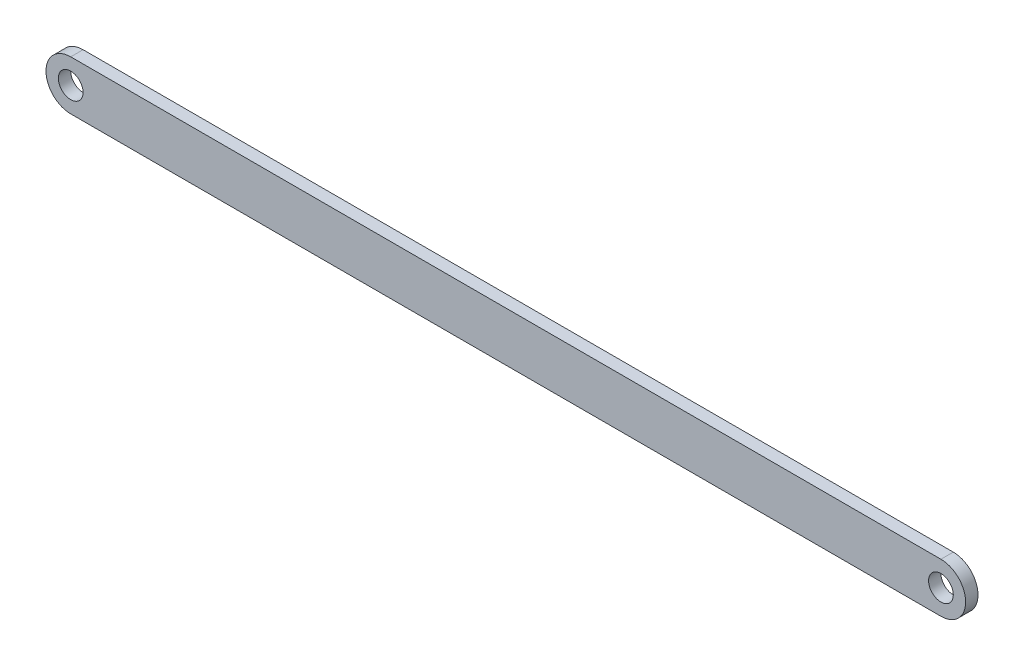
from build123d import *

# Parameters (mm, degrees)
ESBO_O1_R                = 1
RESSALTO_EXTRUS_O1_DEPTH = 1


with BuildPart() as part:
    # Esboço1 → Ressalto-extrusão1 (new body)
    with BuildSketch(Plane.XY):
        with BuildLine():
            Line((-35.21, 2), (35.21, 2))
            ThreePointArc((35.21, 2), (37.21, 0), (35.21, -2))
            Line((35.21, -2), (-35.21, -2))
            ThreePointArc((-35.21, -2), (-37.21, 0), (-35.21, 2))
        make_face()
        with Locations((-35.21, 0)):
            Circle(ESBO_O1_R, mode=Mode.SUBTRACT)
        with Locations((35.21, 0)):
            Circle(ESBO_O1_R, mode=Mode.SUBTRACT)
    extrude(amount=RESSALTO_EXTRUS_O1_DEPTH)


solid = part.part
